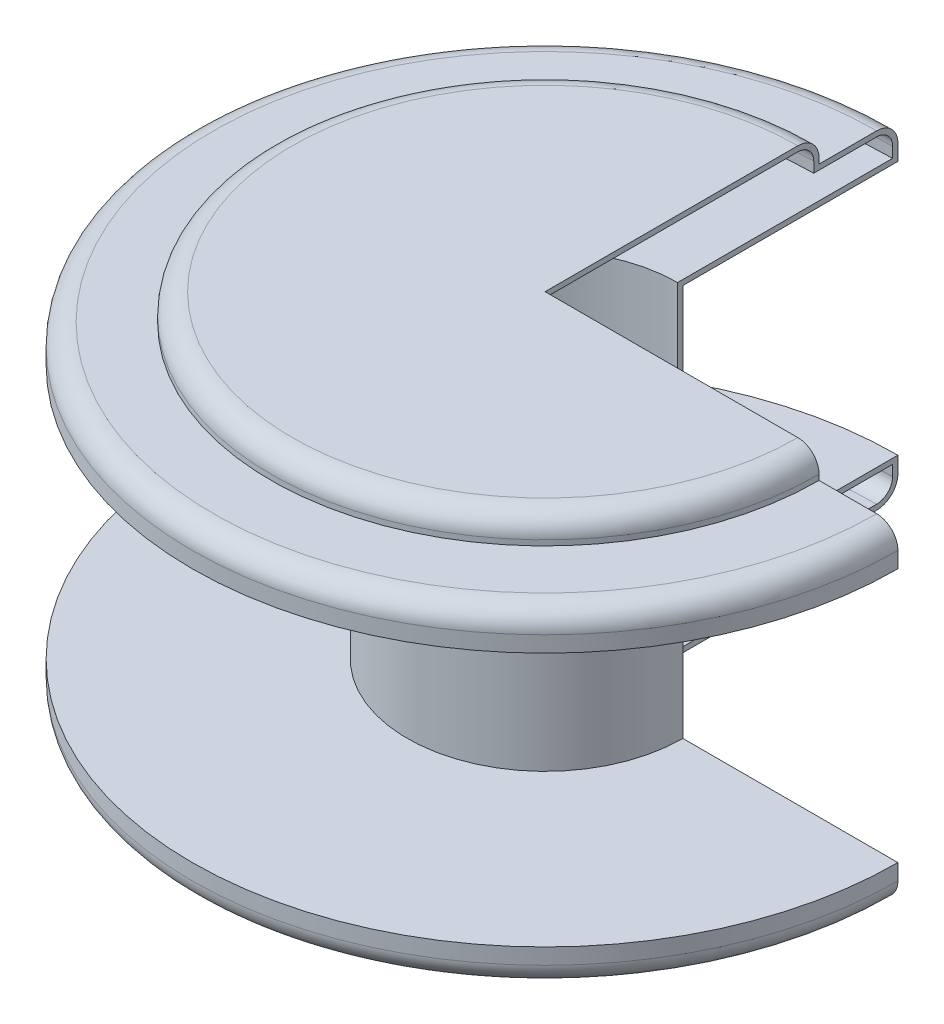
from build123d import *

# Parameters (mm, degrees)
REVOLVE_THIN4_ANGLE = 270


with BuildPart() as part:
    # Sketch1 → Revolve-Thin4 (revolve)
    with BuildSketch(Plane.XY):
        with BuildLine():
            Line((-25, 35), (22.691972887, 35))
            ThreePointArc((22.691972887, 35), (24.813293231, 34.121320344), (25.691972887, 32))
            Line((25.691972887, 32), (25.691972887, 30))
            Line((25.691972887, 30), (37.566272979, 30))
            ThreePointArc((37.566272979, 30), (39.687593323, 29.121320344), (40.566272979, 27))
            Line((40.566272979, 27), (40.566272979, 25))
            Line((40.566272979, 25), (0, 25))
            Line((0, 25), (0, -25))
            Line((0, -25), (40.566272979, -25))
            Line((40.566272979, -25), (40.566272979, -27))
            ThreePointArc((40.566272979, -27), (39.687593323, -29.121320344), (37.566272979, -30))
            Line((37.566272979, -30), (25.691972887, -30))
            Line((25.691972887, -30), (25.691972887, -32))
            ThreePointArc((25.691972887, -32), (24.813293231, -34.121320344), (22.691972887, -35))
            Line((22.691972887, -35), (-25, -35))
            Line((-25, -35), (-25, -36))
            Line((-25, -36), (22.691972887, -36))
            ThreePointArc((22.691972887, -36), (25.520400012, -34.828427125), (26.691972887, -32))
            Line((26.691972887, -32), (26.691972887, -31))
            Line((26.691972887, -31), (37.566272979, -31))
            ThreePointArc((37.566272979, -31), (40.394700104, -29.828427125), (41.566272979, -27))
            Line((41.566272979, -27), (41.566272979, -24))
            Line((41.566272979, -24), (1, -24))
            Line((1, -24), (1, 24))
            Line((1, 24), (41.566272979, 24))
            Line((41.566272979, 24), (41.566272979, 27))
            ThreePointArc((41.566272979, 27), (40.394700104, 29.828427125), (37.566272979, 31))
            Line((37.566272979, 31), (26.691972887, 31))
            Line((26.691972887, 31), (26.691972887, 32))
            ThreePointArc((26.691972887, 32), (25.520400012, 34.828427125), (22.691972887, 36))
            Line((22.691972887, 36), (-25, 36))
            Line((-25, 36), (-25, 35))
        make_face()
    revolve(axis=Axis((-25, 35, 0), (0, -1, 0)), revolution_arc=REVOLVE_THIN4_ANGLE)


solid = part.part
